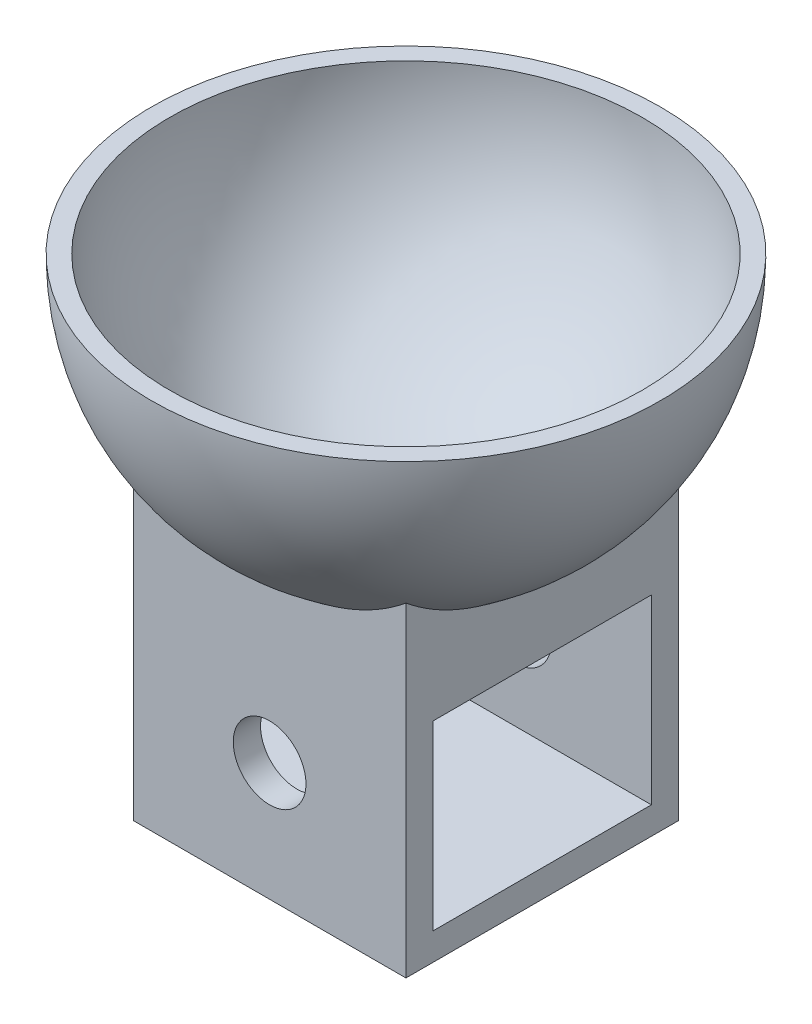
from build123d import *

# Parameters (mm, degrees)
SKETCH1_W           = 30
SKETCH1_H           = 30
BOSS_EXTRUDE1_DEPTH = 26
SHELL1_T            = -3
SKETCH3_R           = 4
CUT_EXTRUDE1_DEPTH  = 43.438190348
BOSS_EXTRUDE2_REACH = 50.497
SKETCH6_W           = 30
SKETCH6_H           = 30


with BuildPart() as part:
    # Sketch1 → Boss-Extrude1 (new body)
    with BuildSketch(Plane(origin=(0, 0, 0), x_dir=(1, 0, 0), z_dir=(0, 1, 0))):
        Rectangle(SKETCH1_W, SKETCH1_H)
    extrude(amount=BOSS_EXTRUDE1_DEPTH)

    # Shell1
    shell1_openings = [part.faces().sort_by_distance(p)[0] for p in [
        (-15, 13, 0),
        (15, 13, 0),
    ]]
    offset(amount=SHELL1_T, openings=shell1_openings, kind=Kind.INTERSECTION)

    # Sketch3 → Cut-Extrude1 (cut, through all)
    with BuildSketch(Plane.XY.offset(15)):
        with Locations((0, 13)):
            Circle(SKETCH3_R)
    extrude(amount=-CUT_EXTRUDE1_DEPTH, mode=Mode.SUBTRACT)


with BuildPart() as body_2:
    # Sketch5 → Revolve1 (revolve)
    with BuildSketch(Plane.XY):
        with BuildLine():
            Line((-28, 54), (-26, 54))
            ThreePointArc((-26, 54), (-18.384776311, 35.615223689), (0, 28))
            Line((0, 28), (0, 26))
            ThreePointArc((0, 26), (-19.798989873, 34.201010127), (-28, 54))
        make_face()
    revolve(axis=Axis((0, 26, 0), (0, 1, 0)))

    # Sketch6 → Boss-Extrude2 (add, up to next)
    with BuildSketch(Plane(origin=(0, 26, 0), x_dir=(1, 0, 0), z_dir=(0, 1, 0)), mode=Mode.PRIVATE) as boss_extrude2_sk1:
        Rectangle(SKETCH6_W, SKETCH6_H)
    boss_extrude2_tool1 = extrude(boss_extrude2_sk1.sketch, amount=BOSS_EXTRUDE2_REACH, mode=Mode.PRIVATE) - body_2.part

    add(part.part)  # Boss-Extrude2 merges part
    add(boss_extrude2_tool1.solids().sort_by_distance((0, 26, 0))[0])


solid = body_2.part
